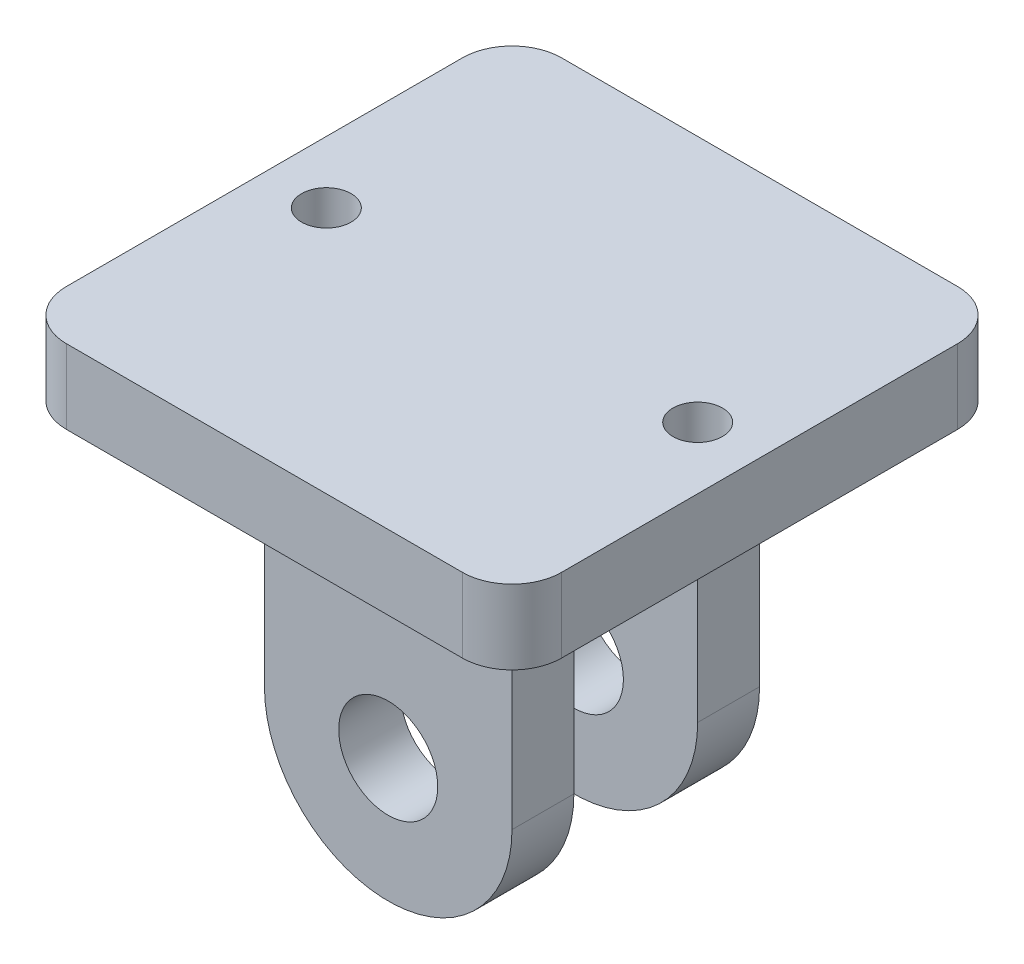
from build123d import *

# Parameters (mm, degrees)
ESQUISSE1_W             = 10
ESQUISSE1_H             = 15
BOSS_EXTRU_1_DEPTH      = 10
CONG_1_RADIUS           = 5
CONG_1_LENGTH           = 10
ESQUISSE3_W             = 5
ESQUISSE3_H             = 12
ENL_V_MAT_EXTRU_1_DEPTH = 10
ESQUISSE4_W             = 10
ESQUISSE4_H             = 10
BOSS_EXTRU_2_DEPTH      = 3
ESQUISSE5_R             = 1
ENL_V_MAT_EXTRU_2_DEPTH = 3
ESQUISSE6_R             = 2
ENL_V_MAT_EXTRU_3_DEPTH = 21.862646045


with BuildPart() as part:
    # Esquisse1 → Boss.-Extru.1 (new body)
    with BuildSketch(Plane.XY):
        Rectangle(ESQUISSE1_W, ESQUISSE1_H)
    extrude(amount=BOSS_EXTRU_1_DEPTH)

    # Congé1: full round fillet: the end face becomes a half cylinder, R = half its width
    cong_1_face = Plane((0, -7.5, 5), x_dir=(0, 0, 1), z_dir=(0, -1, 0))  # on the end face: x along it, z out of the body
    cong_1_slab = cong_1_face.offset(-CONG_1_RADIUS / 2) * Box(CONG_1_LENGTH, 2 * CONG_1_RADIUS, CONG_1_RADIUS, mode=Mode.PRIVATE)  # the body's end, R deep
    cong_1_round = Plane((0, -2.5, 5), x_dir=(0, -1, 0), z_dir=(0, 0, 1)) * Cylinder(CONG_1_RADIUS, CONG_1_LENGTH, mode=Mode.PRIVATE)  # its axis R under the face
    add(cong_1_slab - cong_1_round, mode=Mode.SUBTRACT)

    # Esquisse3 → Enlèv. mat.-Extru.1 (cut)
    with BuildSketch(Plane.ZY.offset(5)):
        with Locations((5, -1.5)):
            Rectangle(ESQUISSE3_W, ESQUISSE3_H)
    extrude(amount=-ENL_V_MAT_EXTRU_1_DEPTH, mode=Mode.SUBTRACT)

    # Esquisse4 → Boss.-Extru.2 (add)
    # profile 1 of 2: a face of its own
    with BuildSketch(Plane(origin=(0, 7.5, 0), x_dir=(1, 0, 0), z_dir=(0, 1, 0))):
        with BuildLine():
            Line((8, 5), (-8, 5))
            ThreePointArc((-8, 5), (-9.414213562, 4.414213562), (-10, 3))
            Line((-10, 3), (-10, -13))
            ThreePointArc((-10, -13), (-9.414213562, -14.414213562), (-8, -15))
            Line((-8, -15), (8, -15))
            ThreePointArc((8, -15), (9.414213562, -14.414213562), (10, -13))
            Line((10, -13), (10, 3))
            ThreePointArc((10, 3), (9.414213562, 4.414213562), (8, 5))
        make_face()
        with Locations((0, -5)):
            Rectangle(ESQUISSE4_W, ESQUISSE4_H, mode=Mode.SUBTRACT)
    # profile 2 of 2: a face of its own
    with BuildSketch(Plane(origin=(0, 7.5, 0), x_dir=(1, 0, 0), z_dir=(0, 1, 0))):
        with Locations((0, -5)):
            Rectangle(ESQUISSE4_W, ESQUISSE4_H)
    extrude(amount=BOSS_EXTRU_2_DEPTH)

    # Esquisse5 → Enlèv. mat.-Extru.2 (cut)
    with BuildSketch(Plane.XZ.offset(-7.5)):
        with Locations(Location((-7.5, 5, 0), (0, 0, 270))):
            Circle(ESQUISSE5_R)
        with Locations(Location((7.5, 5, 0), (0, 0, 270))):
            Circle(ESQUISSE5_R)
    extrude(amount=-ENL_V_MAT_EXTRU_2_DEPTH, mode=Mode.SUBTRACT)

    # Esquisse6 → Enlèv. mat.-Extru.3 (cut, through all)
    with BuildSketch(Plane.XY.offset(10)):
        with Locations((0, -2.5)):
            Circle(ESQUISSE6_R)
    extrude(amount=-ENL_V_MAT_EXTRU_3_DEPTH, mode=Mode.SUBTRACT)


solid = part.part
